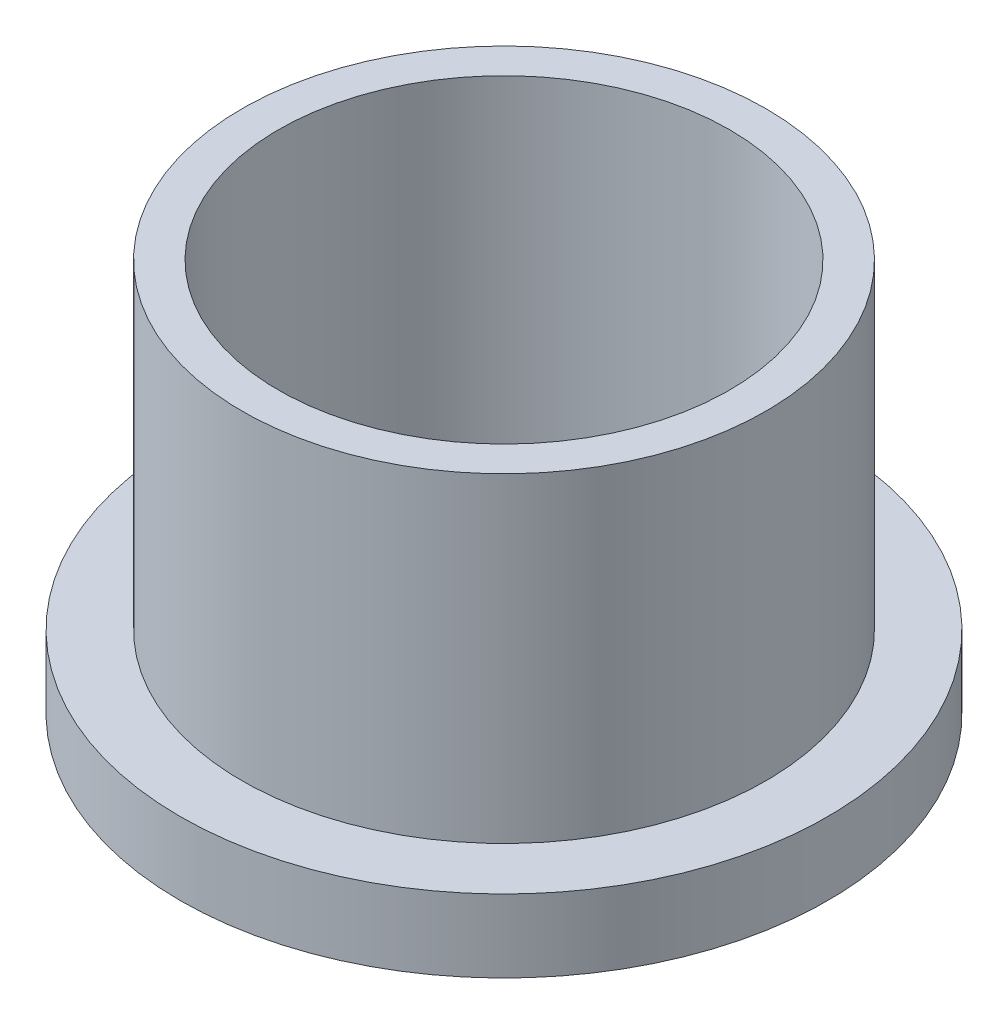
from build123d import *


with BuildPart() as part:
    # Sketch1 → Revolve1 (revolve)
    with BuildSketch(Plane.XY, mode=Mode.PRIVATE) as revolve1_sk:
        Polygon((31, 0), (44.5, 0), (44.5, 10), (36, 10), (36, 54), (31, 54), align=None)
    revolve(revolve1_sk.sketch.rotate(Axis((0, 0, 0), (0, 1, 0)), 90), axis=Axis((0, 0, 0), (0, 1, 0)))


solid = part.part
